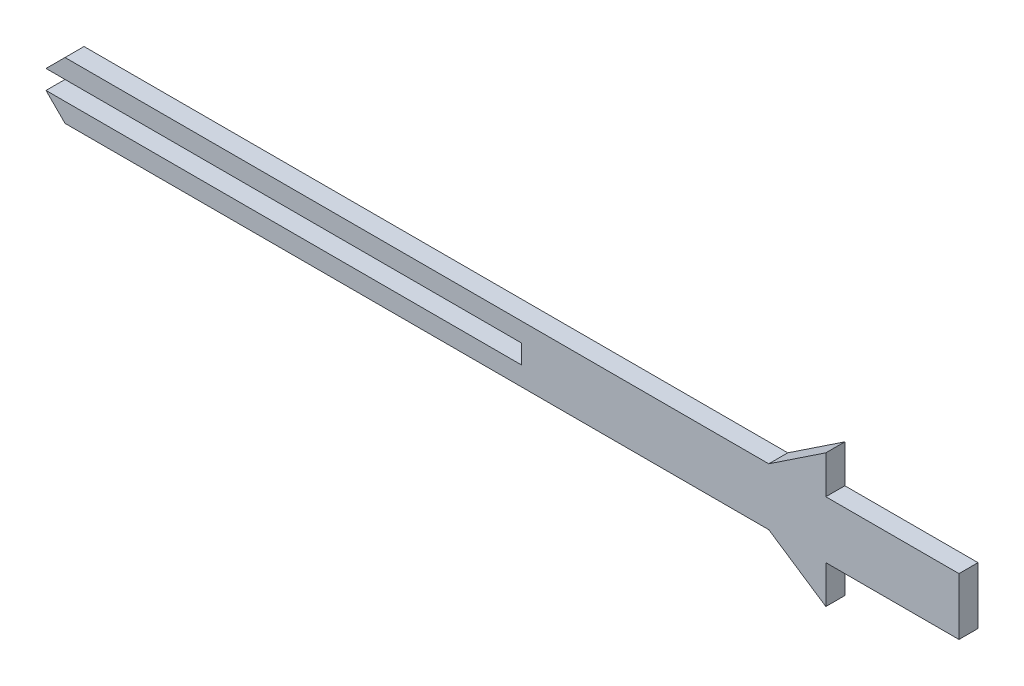
from build123d import *

# Parameters (mm, degrees)
BOSS_EXTRUDE1_DEPTH = 3


with BuildPart() as part:
    # Sketch1 → Boss-Extrude1 (new body)
    with BuildSketch(Plane.XY):
        Polygon((421.29252351, 15.017244097), (421.29252351, 12.017244097), (346.29252351, 12.017244097), (349.29252351, 9.017244097), (460.29252351, 9.017244097), (469.29252351, 3.017244097), (469.29252351, 9.017244097), (490.29252351, 9.017244097), (490.29252351, 18.017244097), (469.29252351, 18.017244097), (469.29252351, 24.017244097), (460.29252351, 18.017244097), (349.29252351, 18.017244097), (346.29252351, 15.017244097), align=None)
    extrude(amount=BOSS_EXTRUDE1_DEPTH)


solid = part.part
